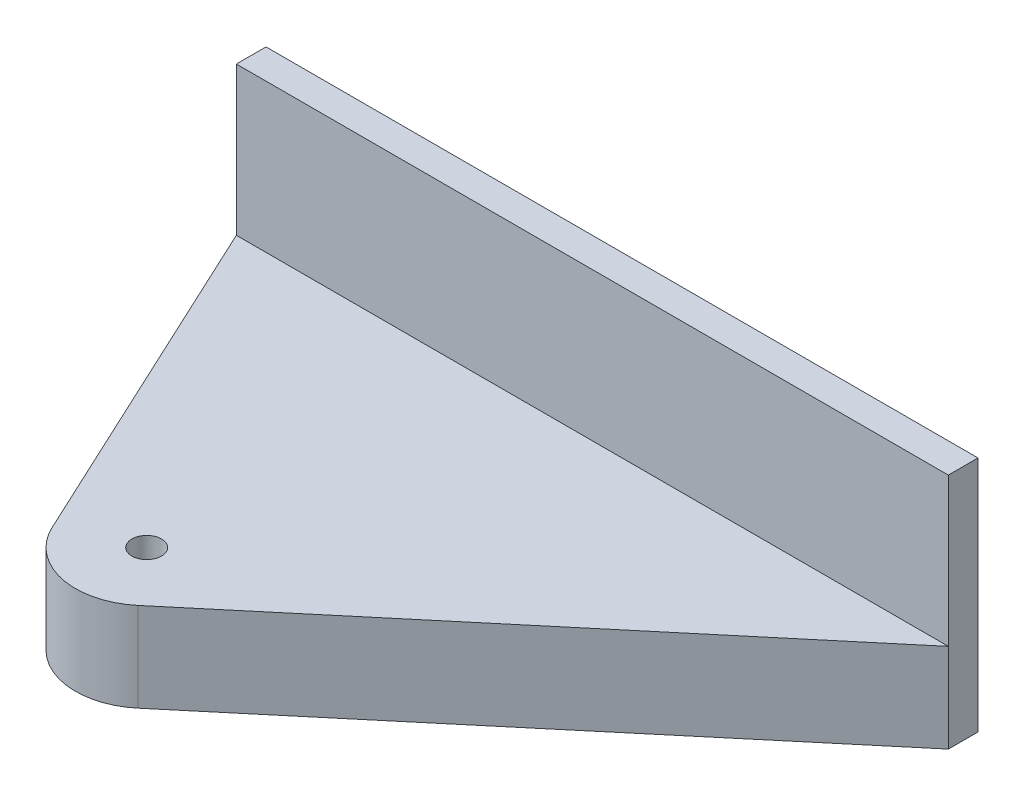
from build123d import *

# Parameters (mm, degrees)
SKETCH1_W               = 76.2
SKETCH1_H               = 25.4
BOSS_EXTRUDE1_DEPTH     = 3.175
BOSS_EXTRUDE2_DEPTH     = 9.525
CUT_EXTRUDE1_DEPTH      = 90.67460564
CUT_EXTRUDE1_DEPTH_BACK = 9.525
SKETCH3_R               = 1.5875


with BuildPart() as part:
    # Sketch1 → Boss-Extrude1 (new body)
    with BuildSketch(Plane.XY):
        with Locations((-38.1, 12.7)):
            Rectangle(SKETCH1_W, SKETCH1_H)
    extrude(amount=BOSS_EXTRUDE1_DEPTH)

    # Sketch2 → Boss-Extrude2 (add)
    with BuildSketch(Plane(origin=(0, 0, 0), x_dir=(-1, 0, 0), z_dir=(0, -1, 0))):
        with BuildLine():
            Line((0, 0), (76.2, 0))
            Line((76.2, 0), (76.2, -3.175))
            Line((76.2, -3.175), (58.966607548, -40.132129378))
            ThreePointArc((58.966607548, -40.132129378), (53.709812069, -44.351153797), (47.162500625, -42.74903688))
            Line((47.162500625, -42.74903688), (0, -3.175))
            Line((0, -3.175), (0, 0))
        make_face()
    extrude(amount=-BOSS_EXTRUDE2_DEPTH)

    # Sketch3 → Cut-Extrude1 (cut, two sides: drawn at the far end of the back side and taken through both)
    with BuildSketch(Plane(origin=(0, 9.525, 0), x_dir=(1, 0, 0), z_dir=(0, 1, 0)).offset(-CUT_EXTRUDE1_DEPTH_BACK)):
        with Locations(Location((-52.060542211, -36.911778223, 0), (0, 0, 180))):
            Circle(SKETCH3_R)
    extrude(amount=CUT_EXTRUDE1_DEPTH + CUT_EXTRUDE1_DEPTH_BACK, mode=Mode.SUBTRACT)


solid = part.part
